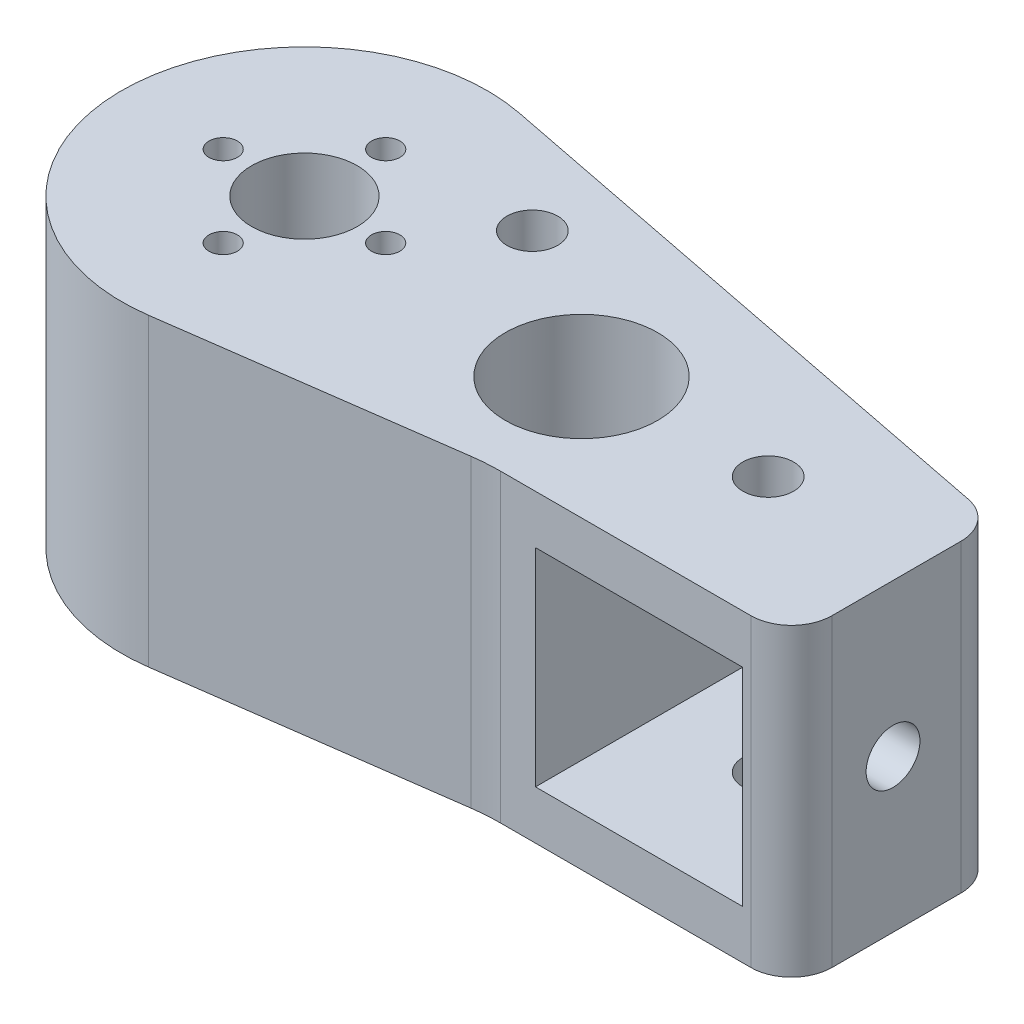
from build123d import *

# Parameters (mm, degrees)
SKETCH1_W           = 30
SKETCH1_H           = 20
BOSS_EXTRUDE1_DEPTH = 30
SKETCH3_R           = 1.4
SKETCH3_R_2         = 5.2
BOSS_EXTRUDE2_DEPTH = 30
SKETCH2_W           = 20.4
SKETCH2_H           = 20.4
CUT_EXTRUDE1_DEPTH  = 79.115650631
SKETCH9_R           = 7.5
CUT_EXTRUDE5_DEPTH  = 75.606681327
SKETCH5_R           = 8.054275222
SKETCH5_R_2         = 5.25
BOSS_EXTRUDE3_DEPTH = 4
SKETCH7_R           = 2.5
CUT_EXTRUDE3_DEPTH  = 75.606681327
CUT_EXTRUDE4_START  = -10
SKETCH8_R           = 2.5
CUT_EXTRUDE4_DEPTH  = 6
FILLET1_R           = 20
SKETCH10_R          = 2.65
CUT_EXTRUDE6_DEPTH  = 16
FILLET2_R           = 4


with BuildPart() as part:
    # Sketch1 → Boss-Extrude1 (new body)
    with BuildSketch(Plane(origin=(0, 0, 0), x_dir=(1, 0, 0), z_dir=(0, 1, 0))):
        Rectangle(SKETCH1_W, SKETCH1_H)
    extrude(amount=BOSS_EXTRUDE1_DEPTH)

    # Sketch3 → Boss-Extrude2 (add)
    # profile 1 of 2: a face of its own
    with BuildSketch(Plane(origin=(0, 30, 0), x_dir=(1, 0, 0), z_dir=(0, 1, 0))):
        with BuildLine():
            Line((-17.722348511, 16.434098612), (-17.722348511, 9.553228991))
            ThreePointArc((-17.722348511, 9.553228991), (-16.337354231, 9.424239155), (-15, 9.041706549))
            Line((-15, 9.041706549), (-15, 10))
            Line((-15, 10), (15, 10))
            Line((15, 10), (-17.722348511, 16.434098612))
        make_face()
    # profile 2 of 2: a face of its own
    with BuildSketch(Plane(origin=(0, 30, 0), x_dir=(1, 0, 0), z_dir=(0, 1, 0))):
        with BuildLine():
            ThreePointArc((-17.722348511, -5.446771009), (-25.222348511, 2.053228991), (-17.722348511, 9.553228991))
            Line((-17.722348511, 9.553228991), (-17.722348511, 16.434098612))
            Line((-17.722348511, 16.434098612), (-43.266218467, 21.456714216))
            ThreePointArc((-43.266218467, 21.456714216), (-64.731658081, 4.309271536), (-44.280895506, -14.036469069))
            Line((-44.280895506, -14.036469069), (-15, -10))
            Line((-15, -10), (-15, -4.935248568))
            ThreePointArc((-15, -4.935248568), (-16.337354231, -5.317781174), (-17.722348511, -5.446771009))
        make_face()
        with Locations(Location((-46.739009009, -4.205101259, 0), (0, 0, 270))):
            Circle(SKETCH3_R, mode=Mode.SUBTRACT)
        with Locations(Location((-54.739009009, 3.794898741, 0), (0, 0, 270))):
            Circle(SKETCH3_R, mode=Mode.SUBTRACT)
        with Locations(Location((-46.739009009, 3.794898741, 0), (0, 0, 270))):
            Circle(SKETCH3_R_2, mode=Mode.SUBTRACT)
        with Locations(Location((-46.739009009, 11.794898741, 0), (0, 0, 270))):
            Circle(SKETCH3_R, mode=Mode.SUBTRACT)
        with Locations(Location((-38.739009009, 3.794898741, 0), (0, 0, 270))):
            Circle(SKETCH3_R, mode=Mode.SUBTRACT)
    extrude(amount=-BOSS_EXTRUDE2_DEPTH)

    # Sketch2 → Cut-Extrude1 (cut, through all)
    with BuildSketch(Plane.XY.offset(10)):
        with Locations((0, 15)):
            Rectangle(SKETCH2_W, SKETCH2_H)
    extrude(amount=-CUT_EXTRUDE1_DEPTH, mode=Mode.SUBTRACT)

    # Sketch9 → Cut-Extrude5 (cut, through all)
    with BuildSketch(Plane(origin=(0, 30, 0), x_dir=(1, 0, 0), z_dir=(0, 1, 0))):
        with Locations(Location((-17.722348511, 2.053228991, 0), (0, 0, 270))):
            Circle(SKETCH9_R)
    extrude(amount=-CUT_EXTRUDE5_DEPTH, mode=Mode.SUBTRACT)

    # Sketch5 → Boss-Extrude3 (add)
    with BuildSketch(Plane.XZ):
        with Locations((-17.722348511, -2.053228991)):
            Circle(SKETCH5_R)
        with Locations(Location((-17.722348511, -2.053228991, 0), (0, 0, 270))):
            Circle(SKETCH5_R_2, mode=Mode.SUBTRACT)
    extrude(amount=-BOSS_EXTRUDE3_DEPTH)

    # Sketch7 → Cut-Extrude3 (cut, through all)
    with BuildSketch(Plane(origin=(0, 30, 0), x_dir=(1, 0, 0), z_dir=(0, 1, 0))):
        with Locations(Location((0, 2.711092918, 0), (0, 0, 270))):
            Circle(SKETCH7_R)
        with Locations(Location((-32.57112446, 12.062397221, 0), (0, 0, 270))):
            Circle(SKETCH7_R)
    extrude(amount=-CUT_EXTRUDE3_DEPTH, mode=Mode.SUBTRACT)

    # Sketch8 → Cut-Extrude4 (cut)
    # profile 1 of 5: a face of its own
    with BuildSketch(Plane(origin=(0, 30, 0), x_dir=(1, 0, 0), z_dir=(0, 1, 0)).offset(CUT_EXTRUDE4_START)):
        Polygon((-31.673466141, 19.177265611), (-34.093809851, 19.653170637), (-39.980668575, 15.078795072), (-38.888173685, 7.153742712), (-31.478629569, 4.13734486), (-25.161580344, 9.045999369), (-26.254075234, 16.971051729), align=None)
        with Locations(Location((-32.57112446, 12.062397221, 0), (0, 0, 270))):
            Circle(SKETCH8_R, mode=Mode.SUBTRACT)
    # profile 2 of 5: a face of its own
    with BuildSketch(Plane(origin=(0, 30, 0), x_dir=(1, 0, 0), z_dir=(0, 1, 0)).offset(CUT_EXTRUDE4_START)):
        Polygon((-34.093809851, 19.653170637), (-33.66361935, 19.987449581), (-31.673466141, 19.177265611), (-26.415693603, 18.143445347), (-27.334766958, 24.810482895), (-41.061360298, 22.918226238), (-40.792843449, 20.970381801), align=None)
    # profile 3 of 5: a face of its own
    with BuildSketch(Plane(origin=(0, 30, 0), x_dir=(1, 0, 0), z_dir=(0, 1, 0)).offset(CUT_EXTRUDE4_START)):
        Polygon((-26.415693603, 18.143445347), (-31.673466141, 19.177265611), (-26.254075234, 16.971051729), align=None)
    # profile 4 of 5: a face of its own
    with BuildSketch(Plane(origin=(0, 30, 0), x_dir=(1, 0, 0), z_dir=(0, 1, 0)).offset(CUT_EXTRUDE4_START)):
        Polygon((-39.980668575, 15.078795072), (-34.093809851, 19.653170637), (-40.792843449, 20.970381801), align=None)
    # profile 5 of 5: a face of its own
    with BuildSketch(Plane(origin=(0, 30, 0), x_dir=(1, 0, 0), z_dir=(0, 1, 0)).offset(CUT_EXTRUDE4_START)):
        Polygon((-31.673466141, 19.177265611), (-33.66361935, 19.987449581), (-34.093809851, 19.653170637), align=None)
    extrude(amount=-CUT_EXTRUDE4_DEPTH, mode=Mode.SUBTRACT)

    # Fillet1
    fillet1_edges = [part.edges().sort_by_distance(p)[0] for p in [
        (-15, 15, 10),
    ]]
    fillet(fillet1_edges, radius=FILLET1_R)

    # Sketch10 → Cut-Extrude6 (cut)
    with BuildSketch(Plane(origin=(15, 0, 0), x_dir=(0, 0, -1), z_dir=(1, 0, 0))):
        with Locations((0, 15)):
            Circle(SKETCH10_R)
    extrude(amount=-CUT_EXTRUDE6_DEPTH, mode=Mode.SUBTRACT)

    # Fillet2
    fillet2_edges = [part.edges().sort_by_distance(p)[0] for p in [
        (15, 15, 10),
        (15, 15, -10),
    ]]
    fillet(fillet2_edges, radius=FILLET2_R)


solid = part.part
